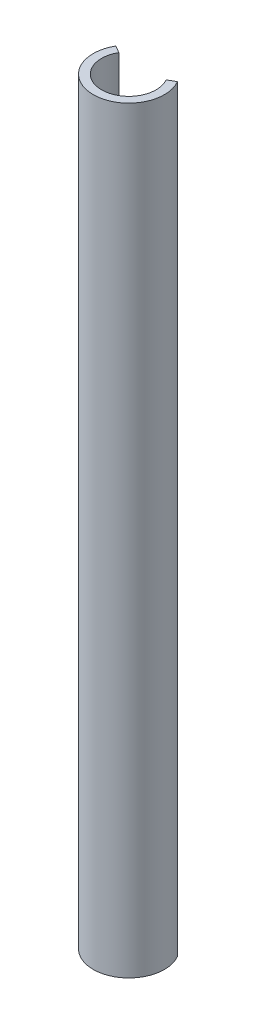
from build123d import *

# Parameters (mm, degrees)
BOSS_EXTRUDE1_DEPTH = 500


with BuildPart() as part:
    # Sketch1 → Boss-Extrude1 (new body)
    with BuildSketch(Plane(origin=(0, 0, 0), x_dir=(1, 0, 0), z_dir=(0, 1, 0))):
        with BuildLine():
            Line((15.588457268, 9), (20.351596989, 11.75))
            ThreePointArc((20.351596989, 11.75), (0, -23.5), (-20.351596989, 11.75))
            Line((-20.351596989, 11.75), (-15.588457268, 9))
            ThreePointArc((-15.588457268, 9), (0, -18), (15.588457268, 9))
        make_face()
    extrude(amount=BOSS_EXTRUDE1_DEPTH)


solid = part.part
